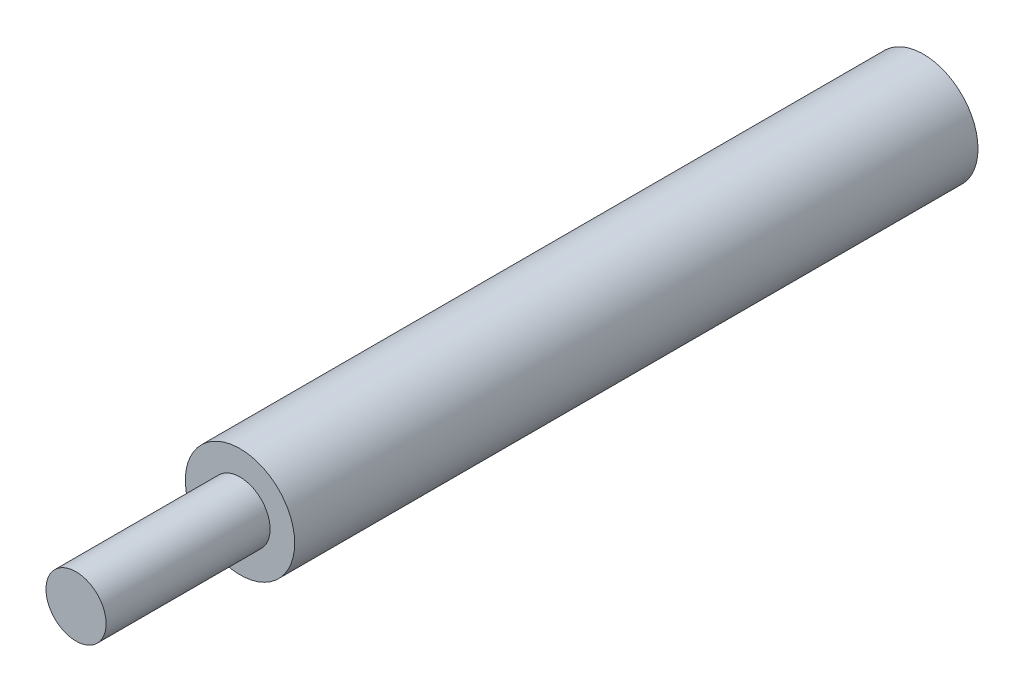
from build123d import *

# Parameters (mm, degrees)
SKETCH1_R           = 4
BOSS_EXTRUDE1_DEPTH = 50
SKETCH2_R           = 2.2
BOSS_EXTRUDE2_DEPTH = 12


with BuildPart() as part:
    # Sketch1 → Boss-Extrude1 (new body)
    with BuildSketch(Plane.XY):
        Circle(SKETCH1_R)
    extrude(amount=BOSS_EXTRUDE1_DEPTH)

    # Sketch2 → Boss-Extrude2 (add)
    with BuildSketch(Plane.XY.offset(50)):
        Circle(SKETCH2_R)
    extrude(amount=BOSS_EXTRUDE2_DEPTH)


solid = part.part
